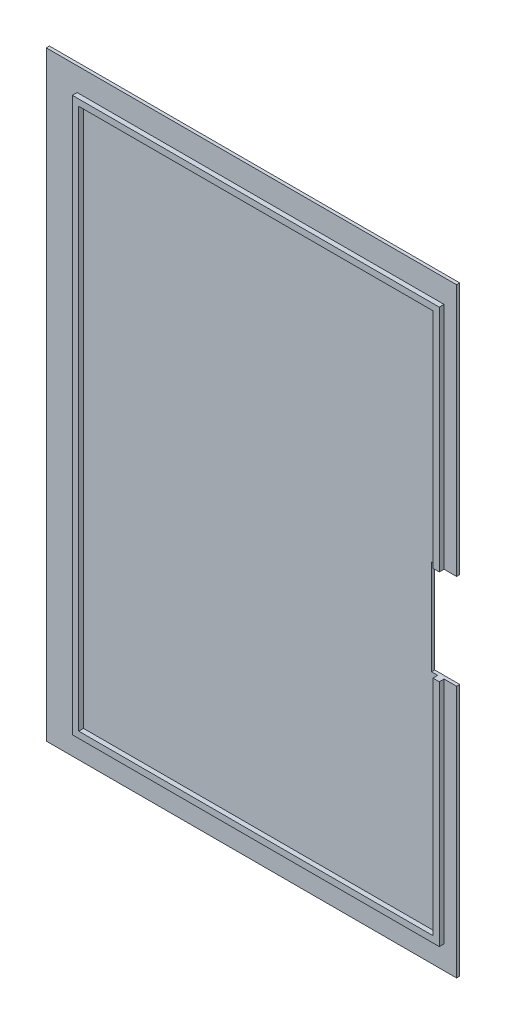
from build123d import *

# Parameters (mm, degrees)
SKETCH_1_W          = 129.5
SKETCH_1_H          = 189.5
EXTRUDE_1_DEPTH     = 1
SKETCH_2_W          = 115.8
SKETCH_2_H          = 174.8
SKETCH_2_W_2        = 111.8
SKETCH_2_H_2        = 170.8
EXTRUDE_2_DEPTH     = 1.5
SKETCH_3_W          = 7.9
SKETCH_3_H          = 30
CUT_EXTRUDE_1_DEPTH = 3


with BuildPart() as part:
    # 草图1 → 凸台-拉伸1 (new body)
    with BuildSketch(Plane.XY):
        Rectangle(SKETCH_1_W, SKETCH_1_H)
    extrude(amount=EXTRUDE_1_DEPTH)

    # 草图2 → 凸台-拉伸2 (add)
    with BuildSketch(Plane.XY.offset(1)):
        with Locations((2.9, 0)):
            Rectangle(SKETCH_2_W, SKETCH_2_H)
        with Locations((2.9, 0)):
            Rectangle(SKETCH_2_W_2, SKETCH_2_H_2, mode=Mode.SUBTRACT)
    extrude(amount=EXTRUDE_2_DEPTH)

    # 草图3 → 切除-拉伸1 (cut)
    with BuildSketch(Plane.XY.offset(2.5)):
        with Locations((60.8, 0)):
            Rectangle(SKETCH_3_W, SKETCH_3_H)
    extrude(amount=-CUT_EXTRUDE_1_DEPTH, mode=Mode.SUBTRACT)


solid = part.part
